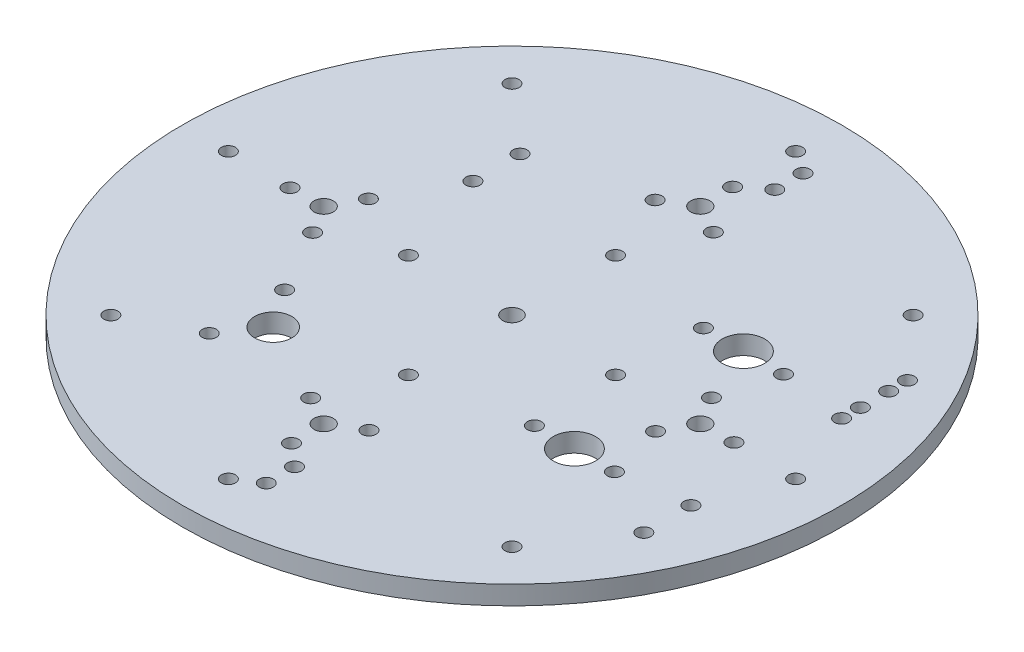
from build123d import *

# Parameters (mm, degrees)
SKETCH2_R           = 70
BOSS_EXTRUDE1_DEPTH = 4
SKETCH8_R           = 2
CUT_EXTRUDE1_DEPTH  = 100.075728612
SKETCH34_R          = 1.5
CUT_EXTRUDE8_DEPTH  = 100.075728612
CIRPATTERN7_COUNT   = 8
SKETCH50_R          = 1.5
CUT_EXTRUDE15_DEPTH = 100.075728612
SKETCH51_R          = 1.5
CUT_EXTRUDE16_DEPTH = 100.075728612
SKETCH56_R          = 2.05
CUT_EXTRUDE19_DEPTH = 100.075728612
SKETCH57_R          = 1.5
CUT_EXTRUDE20_DEPTH = 100.075728612
CIRPATTERN13_COUNT  = 4
SKETCH60_R          = 1.5
CUT_EXTRUDE21_DEPTH = 100.075728612
CIRPATTERN14_COUNT  = 4
SKETCH49_R          = 4.5
SKETCH49_R_2        = 3.95
CUT_EXTRUDE14_DEPTH = 100.075728612
SKETCH63_R          = 1.5
CUT_EXTRUDE24_DEPTH = 100.075728612
SKETCH64_R          = 1.5
CUT_EXTRUDE25_DEPTH = 100.075728612
SKETCH65_R          = 1.5
CUT_EXTRUDE26_DEPTH = 100.075728612


with BuildPart() as part:
    # Sketch2 → Boss-Extrude1 (new body)
    with BuildSketch(Plane(origin=(0, 0, 0), x_dir=(1, 0, 0), z_dir=(0, 1, 0))):
        Circle(SKETCH2_R)
    extrude(amount=BOSS_EXTRUDE1_DEPTH)

    # Sketch8 → Cut-Extrude1 (cut, through all)
    with BuildSketch(Plane(origin=(0, 4, 0), x_dir=(1, 0, 0), z_dir=(0, 1, 0))):
        Circle(SKETCH8_R)
    extrude(amount=-CUT_EXTRUDE1_DEPTH, mode=Mode.SUBTRACT)

    # Sketch34 → Cut-Extrude8 (cut, through all)
    with BuildSketch(Plane(origin=(0, 4, 0), x_dir=(1, 0, 0), z_dir=(0, 1, 0))):
        with Locations((-60.25, 0)):
            Circle(SKETCH34_R)
    cut_extrude8 = extrude(amount=-CUT_EXTRUDE8_DEPTH, mode=Mode.SUBTRACT)

    # CirPattern7: Cut-Extrude8 ×8 about axis
    cirpattern7_axis = Axis((0, 4, 0), (0, -1, 0))
    for i in range(1, CIRPATTERN7_COUNT):
        add(cut_extrude8.rotate(cirpattern7_axis, i * 360 / CIRPATTERN7_COUNT), mode=Mode.SUBTRACT)

    # Sketch50 → Cut-Extrude15 (cut, through all)
    with BuildSketch(Plane.XZ):
        with Locations((-28.8, -30.5)):
            Circle(SKETCH50_R)
        with Locations((-28.8, -20.5)):
            Circle(SKETCH50_R)
        with Locations((54, -26)):
            Circle(SKETCH50_R)
        with Locations((54, -16)):
            Circle(SKETCH50_R)
        with Locations((54, 16)):
            Circle(SKETCH50_R)
        with Locations((54, 26)):
            Circle(SKETCH50_R)
    extrude(amount=-CUT_EXTRUDE15_DEPTH, mode=Mode.SUBTRACT)

    # Sketch51 → Cut-Extrude16 (cut, through all)
    with BuildSketch(Plane.XZ):
        with Locations((-28.8, 19.5)):
            Circle(SKETCH51_R)
        with Locations((-28.8, 35.5)):
            Circle(SKETCH51_R)
    extrude(amount=-CUT_EXTRUDE16_DEPTH, mode=Mode.SUBTRACT)

    # Sketch56 → Cut-Extrude19 (cut, through all)
    with BuildSketch(Plane(origin=(0, 4, 0), x_dir=(1, 0, 0), z_dir=(0, 1, 0))):
        with Locations((0, 40)):
            Circle(SKETCH56_R)
        with Locations((-40, 0)):
            Circle(SKETCH56_R)
        with Locations((40, 0)):
            Circle(SKETCH56_R)
        with Locations((0, -40)):
            Circle(SKETCH56_R)
    extrude(amount=-CUT_EXTRUDE19_DEPTH, mode=Mode.SUBTRACT)

    # Sketch57 → Cut-Extrude20 (cut, through all)
    with BuildSketch(Plane(origin=(0, 4, 0), x_dir=(1, 0, 0), z_dir=(0, 1, 0))):
        with Locations((-36.371259829, -5.986004074)):
            Circle(SKETCH57_R)
        with Locations((-46.998401681, -0.149579135)):
            Circle(SKETCH57_R)
        with Locations((-36.63033849, 6.135583209)):
            Circle(SKETCH57_R)
    cut_extrude20 = extrude(amount=-CUT_EXTRUDE20_DEPTH, mode=Mode.SUBTRACT)

    # CirPattern13: Cut-Extrude20 ×4 about axis
    cirpattern13_axis = Axis((0, 4, 0), (0, 1, 0))
    for i in range(1, CIRPATTERN13_COUNT):
        add(cut_extrude20.rotate(cirpattern13_axis, i * 360 / CIRPATTERN13_COUNT), mode=Mode.SUBTRACT)

    # Sketch60 → Cut-Extrude21 (cut, through all)
    with BuildSketch(Plane(origin=(0, 4, 0), x_dir=(1, 0, 0), z_dir=(0, 1, 0))):
        with Locations((22, 0)):
            Circle(SKETCH60_R)
    cut_extrude21 = extrude(amount=-CUT_EXTRUDE21_DEPTH, mode=Mode.SUBTRACT)

    # CirPattern14: Cut-Extrude21 ×4 about axis
    cirpattern14_axis = Axis((0, 4, 0), (0, -1, 0))
    for i in range(1, CIRPATTERN14_COUNT):
        add(cut_extrude21.rotate(cirpattern14_axis, i * 360 / CIRPATTERN14_COUNT), mode=Mode.SUBTRACT)

    # Sketch49 → Cut-Extrude14 (cut, through all)
    with BuildSketch(Plane.XZ):
        with Locations((31.205728641, 17.95)):
            Circle(SKETCH49_R)
        with Locations((31.205728641, -17.95)):
            Circle(SKETCH49_R)
        with Locations((-23.140353949, 27.577599952)):
            Circle(SKETCH49_R_2)
    extrude(amount=-CUT_EXTRUDE14_DEPTH, mode=Mode.SUBTRACT)

    # Sketch63 → Cut-Extrude24 (cut, through all)
    with BuildSketch(Plane.XZ):
        with Locations((22.705728641, -17.95)):
            Circle(SKETCH63_R)
        with Locations((39.705728641, -17.95)):
            Circle(SKETCH63_R)
        with Locations((22.705728641, 17.95)):
            Circle(SKETCH63_R)
        with Locations((39.705728641, 17.95)):
            Circle(SKETCH63_R)
    extrude(amount=-CUT_EXTRUDE24_DEPTH, mode=Mode.SUBTRACT)

    # Sketch64 → Cut-Extrude25 (cut, through all)
    with BuildSketch(Plane.XZ):
        with Locations((4.805728641, -57)):
            Circle(SKETCH64_R)
        with Locations((4.805728641, -51)):
            Circle(SKETCH64_R)
        with Locations((4.805728641, 51)):
            Circle(SKETCH64_R)
        with Locations((4.805728641, 57)):
            Circle(SKETCH64_R)
    extrude(amount=-CUT_EXTRUDE25_DEPTH, mode=Mode.SUBTRACT)

    # Sketch65 → Cut-Extrude26 (cut, through all)
    with BuildSketch(Plane.XZ):
        with Locations((54, -30)):
            Circle(SKETCH65_R)
        with Locations((54, -20)):
            Circle(SKETCH65_R)
    extrude(amount=-CUT_EXTRUDE26_DEPTH, mode=Mode.SUBTRACT)


solid = part.part
